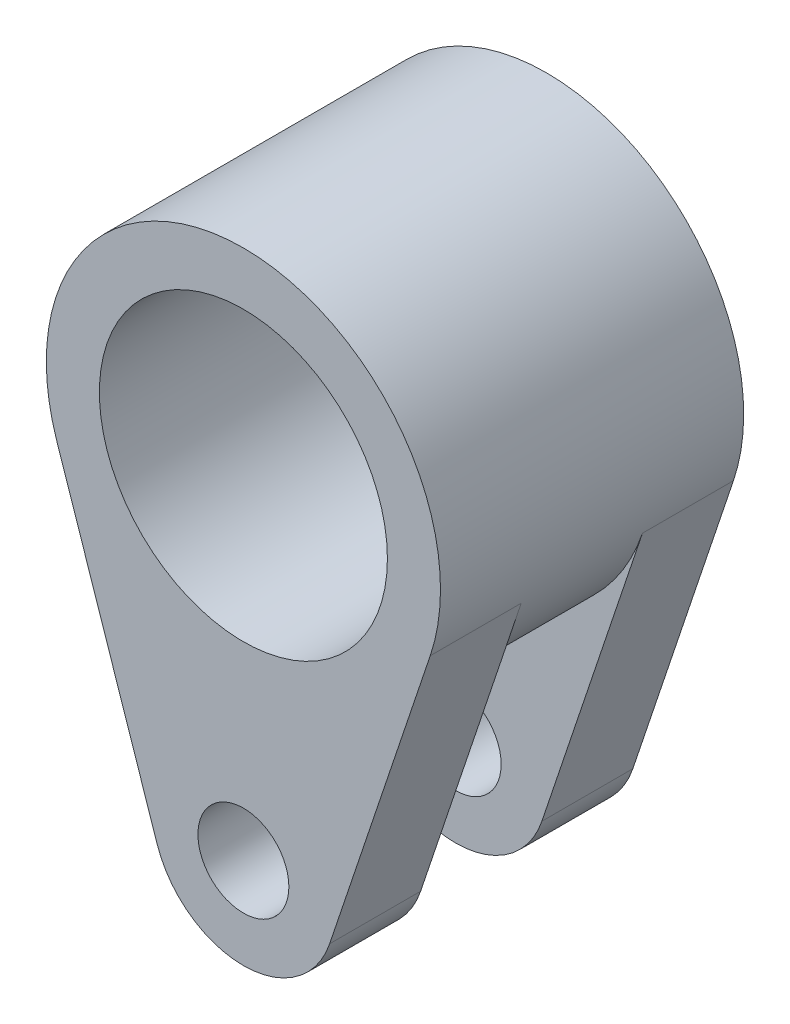
from build123d import *

# Parameters (mm, degrees)
SKETCH1_R               = 13
BOSS_EXTRUDE1_DEPTH     = 10
SKETCH2_R               = 3
BOSS_EXTRUDE2_DEPTH     = 6
CUT_EXTRUDE1_DEPTH      = 37.783148315
CUT_EXTRUDE1_DEPTH_BACK = 37.783148315
SKETCH3_R               = 9.5


with BuildPart() as part:
    # Sketch1 → Boss-Extrude1 (new, symmetric)
    with BuildSketch(Plane(origin=(0, 0, 0), x_dir=(0, 1, 0), z_dir=(0, 0, 1))):
        with Locations(Location((0, 0, 0), (0, 0, 270))):
            Circle(SKETCH1_R)
    extrude(amount=BOSS_EXTRUDE1_DEPTH, both=True)

    # Sketch2 → Boss-Extrude2 (add)
    with BuildSketch(Plane.XY.offset(10)):
        with BuildLine():
            Line((-12.324386227, -4.136363636), (-5.688178259, -23.909090909))
            ThreePointArc((-5.688178259, -23.909090909), (0, -28), (5.688178259, -23.909090909))
            Line((5.688178259, -23.909090909), (12.324386227, -4.136363636))
            ThreePointArc((12.324386227, -4.136363636), (0, 13), (-12.324386227, -4.136363636))
        make_face()
        with Locations((0, -22)):
            Circle(SKETCH2_R, mode=Mode.SUBTRACT)
    boss_extrude2 = extrude(amount=-BOSS_EXTRUDE2_DEPTH)

    # Mirror1: Boss-Extrude2 across plane
    add(boss_extrude2.mirror(Plane.XY))

    # Sketch3 → Cut-Extrude1 (cut, two sides: drawn at the far end of the back side and taken through both)
    with BuildSketch(Plane.XY.offset(10).offset(-CUT_EXTRUDE1_DEPTH_BACK)):
        Circle(SKETCH3_R)
    extrude(amount=CUT_EXTRUDE1_DEPTH + CUT_EXTRUDE1_DEPTH_BACK, mode=Mode.SUBTRACT)


solid = part.part
